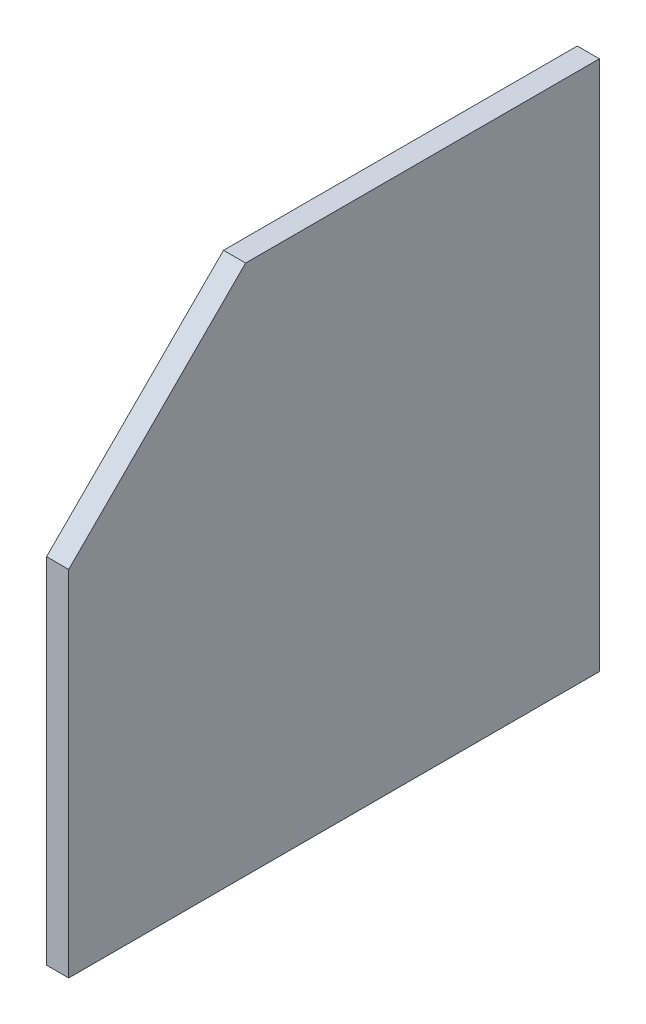
from build123d import *

# Parameters (mm, degrees)
BOSS_EXTRUDE1_DEPTH = 3.175


with BuildPart() as part:
    # Sketch1 → Boss-Extrude1 (new body)
    with BuildSketch(Plane(origin=(0, 0, 0), x_dir=(0, 0, -1), z_dir=(1, 0, 0))):
        Polygon((38.1, 38.1), (-12.7, 38.1), (-38.1, 12.7), (-38.1, -38.1), (38.1, -38.1), align=None)
    extrude(amount=BOSS_EXTRUDE1_DEPTH)


solid = part.part
